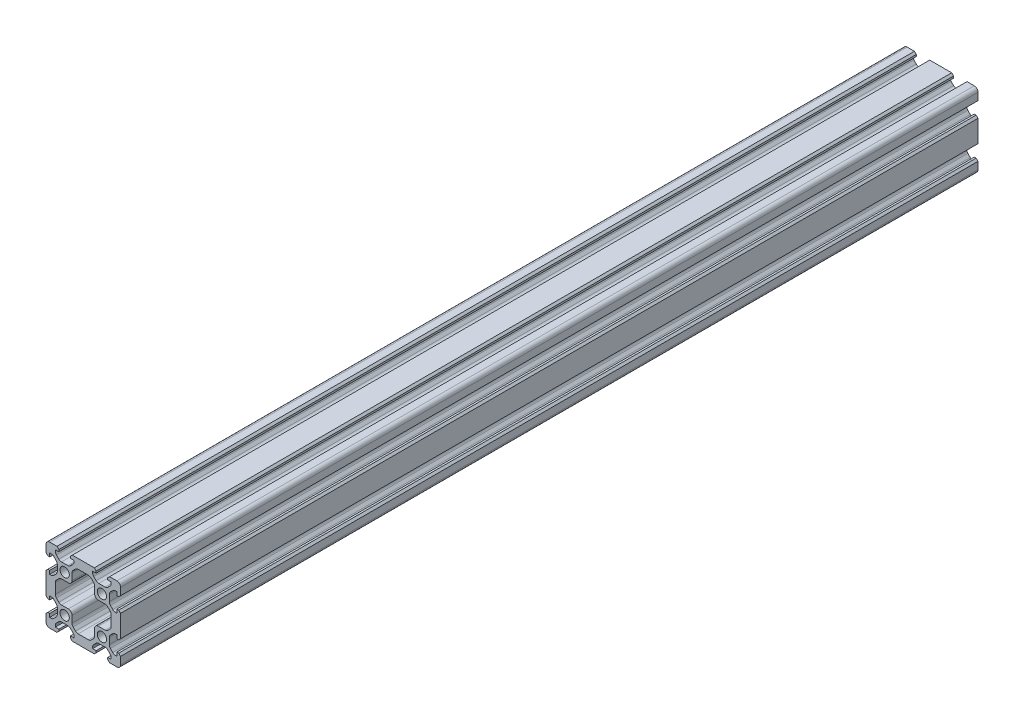
from build123d import *

# Parameters (mm, degrees)
SKETCH1_R           = 2.5
BOSS_EXTRUDE1_DEPTH = 460


with BuildPart() as part:
    # Sketch1 → Boss-Extrude1 (new body)
    with BuildSketch(Plane.XY):
        with BuildLine():
            Line((-13.1, -19), (-14.1, -20))
            Line((-14.1, -20), (-18, -20))
            ThreePointArc((-18, -20), (-19.414213562, -19.414213562), (-20, -18))
            Line((-20, -18), (-20, -14.1))
            Line((-20, -14.1), (-19, -13.1))
            Line((-19, -13.1), (-18, -13.1))
            Line((-18, -13.1), (-18, -15))
            Line((-18, -15), (-17.242640687, -15))
            ThreePointArc((-17.242640687, -15), (-16.477273822, -14.847759065), (-15.828427125, -14.414213562))
            Line((-15.828427125, -14.414213562), (-14.537854624, -13.123641061))
            ThreePointArc((-14.537854624, -13.123641061), (-14.104309121, -12.474794364), (-13.952068186, -11.709427499))
            Line((-13.952068186, -11.709427499), (-13.952068186, -8.290572501))
            ThreePointArc((-13.952068186, -8.290572501), (-14.104309121, -7.525205636), (-14.537854624, -6.876358939))
            Line((-14.537854624, -6.876358939), (-15.828427125, -5.585786438))
            ThreePointArc((-15.828427125, -5.585786438), (-16.477273822, -5.152240935), (-17.242640687, -5))
            Line((-17.242640687, -5), (-18, -5))
            Line((-18, -5), (-18, -6.9))
            Line((-18, -6.9), (-19, -6.9))
            Line((-19, -6.9), (-20, -5.9))
            Line((-20, -5.9), (-20, 5.9))
            Line((-20, 5.9), (-19, 6.9))
            Line((-19, 6.9), (-18, 6.9))
            Line((-18, 6.9), (-18, 5))
            Line((-18, 5), (-17.242640687, 5))
            ThreePointArc((-17.242640687, 5), (-16.477273822, 5.152240935), (-15.828427125, 5.585786438))
            Line((-15.828427125, 5.585786438), (-14.537854624, 6.876358939))
            ThreePointArc((-14.537854624, 6.876358939), (-14.104309121, 7.525205636), (-13.952068186, 8.290572501))
            Line((-13.952068186, 8.290572501), (-13.952068186, 11.709427499))
            ThreePointArc((-13.952068186, 11.709427499), (-14.104309121, 12.474794364), (-14.537854624, 13.123641061))
            Line((-14.537854624, 13.123641061), (-15.828427125, 14.414213562))
            ThreePointArc((-15.828427125, 14.414213562), (-16.477273822, 14.847759065), (-17.242640687, 15))
            Line((-17.242640687, 15), (-18, 15))
            Line((-18, 15), (-18, 13.1))
            Line((-18, 13.1), (-19, 13.1))
            Line((-19, 13.1), (-20, 14.1))
            Line((-20, 14.1), (-20, 18))
            ThreePointArc((-20, 18), (-19.414213562, 19.414213562), (-18, 20))
            Line((-18, 20), (-14.1, 20))
            Line((-14.1, 20), (-13.1, 19))
            Line((-13.1, 19), (-13.1, 18))
            Line((-13.1, 18), (-15, 18))
            Line((-15, 18), (-15, 17.242640687))
            ThreePointArc((-15, 17.242640687), (-14.847759065, 16.477273822), (-14.414213562, 15.828427125))
            Line((-14.414213562, 15.828427125), (-13.123641061, 14.537854624))
            ThreePointArc((-13.123641061, 14.537854624), (-12.474794364, 14.104309121), (-11.709427499, 13.952068186))
            Line((-11.709427499, 13.952068186), (-8.290572501, 13.952068186))
            ThreePointArc((-8.290572501, 13.952068186), (-7.525205636, 14.104309121), (-6.876358939, 14.537854624))
            Line((-6.876358939, 14.537854624), (-5.585786438, 15.828427125))
            ThreePointArc((-5.585786438, 15.828427125), (-5.152240935, 16.477273822), (-5, 17.242640687))
            Line((-5, 17.242640687), (-5, 18))
            Line((-5, 18), (-6.9, 18))
            Line((-6.9, 18), (-6.9, 19))
            Line((-6.9, 19), (-5.9, 20))
            Line((-5.9, 20), (5.9, 20))
            Line((5.9, 20), (6.9, 19))
            Line((6.9, 19), (6.9, 18))
            Line((6.9, 18), (5, 18))
            Line((5, 18), (5, 17.242640687))
            ThreePointArc((5, 17.242640687), (5.152240935, 16.477273822), (5.585786438, 15.828427125))
            Line((5.585786438, 15.828427125), (6.876358939, 14.537854624))
            ThreePointArc((6.876358939, 14.537854624), (7.525205636, 14.104309121), (8.290572501, 13.952068186))
            Line((8.290572501, 13.952068186), (11.709427499, 13.952068186))
            ThreePointArc((11.709427499, 13.952068186), (12.474794364, 14.104309121), (13.123641061, 14.537854624))
            Line((13.123641061, 14.537854624), (14.414213562, 15.828427125))
            ThreePointArc((14.414213562, 15.828427125), (14.847759065, 16.477273822), (15, 17.242640687))
            Line((15, 17.242640687), (15, 18))
            Line((15, 18), (13.1, 18))
            Line((13.1, 18), (13.1, 19))
            Line((13.1, 19), (14.1, 20))
            Line((14.1, 20), (18, 20))
            ThreePointArc((18, 20), (19.414213562, 19.414213562), (20, 18))
            Line((20, 18), (20, 14.1))
            Line((20, 14.1), (19, 13.1))
            Line((19, 13.1), (18, 13.1))
            Line((18, 13.1), (18, 15))
            Line((18, 15), (17.242640687, 15))
            ThreePointArc((17.242640687, 15), (16.477273822, 14.847759065), (15.828427125, 14.414213562))
            Line((15.828427125, 14.414213562), (14.537854624, 13.123641061))
            ThreePointArc((14.537854624, 13.123641061), (14.104309121, 12.474794364), (13.952068186, 11.709427499))
            Line((13.952068186, 11.709427499), (13.952068186, 8.290572501))
            ThreePointArc((13.952068186, 8.290572501), (14.104309121, 7.525205636), (14.537854624, 6.876358939))
            Line((14.537854624, 6.876358939), (15.828427125, 5.585786438))
            ThreePointArc((15.828427125, 5.585786438), (16.477273822, 5.152240935), (17.242640687, 5))
            Line((17.242640687, 5), (18, 5))
            Line((18, 5), (18, 6.9))
            Line((18, 6.9), (19, 6.9))
            Line((19, 6.9), (20, 5.9))
            Line((20, 5.9), (20, -5.9))
            Line((20, -5.9), (19, -6.9))
            Line((19, -6.9), (18, -6.9))
            Line((18, -6.9), (18, -5))
            Line((18, -5), (17.242640687, -5))
            ThreePointArc((17.242640687, -5), (16.477273822, -5.152240935), (15.828427125, -5.585786438))
            Line((15.828427125, -5.585786438), (14.537854624, -6.876358939))
            ThreePointArc((14.537854624, -6.876358939), (14.104309121, -7.525205636), (13.952068186, -8.290572501))
            Line((13.952068186, -8.290572501), (13.952068186, -11.709427499))
            ThreePointArc((13.952068186, -11.709427499), (14.104309121, -12.474794364), (14.537854624, -13.123641061))
            Line((14.537854624, -13.123641061), (15.828427125, -14.414213562))
            ThreePointArc((15.828427125, -14.414213562), (16.477273822, -14.847759065), (17.242640687, -15))
            Line((17.242640687, -15), (18, -15))
            Line((18, -15), (18, -13.1))
            Line((18, -13.1), (19, -13.1))
            Line((19, -13.1), (20, -14.1))
            Line((20, -14.1), (20, -18))
            ThreePointArc((20, -18), (19.414213562, -19.414213562), (18, -20))
            Line((18, -20), (14.1, -20))
            Line((14.1, -20), (13.1, -19))
            Line((13.1, -19), (13.1, -18))
            Line((13.1, -18), (15, -18))
            Line((15, -18), (15, -17.242640687))
            ThreePointArc((15, -17.242640687), (14.847759065, -16.477273822), (14.414213562, -15.828427125))
            Line((14.414213562, -15.828427125), (13.123641061, -14.537854624))
            ThreePointArc((13.123641061, -14.537854624), (12.474794364, -14.104309121), (11.709427499, -13.952068186))
            Line((11.709427499, -13.952068186), (8.290572501, -13.952068186))
            ThreePointArc((8.290572501, -13.952068186), (7.525205636, -14.104309121), (6.876358939, -14.537854624))
            Line((6.876358939, -14.537854624), (5.585786438, -15.828427125))
            ThreePointArc((5.585786438, -15.828427125), (5.152240935, -16.477273822), (5, -17.242640687))
            Line((5, -17.242640687), (5, -18))
            Line((5, -18), (6.9, -18))
            Line((6.9, -18), (6.9, -19))
            Line((6.9, -19), (5.9, -20))
            Line((5.9, -20), (-5.9, -20))
            Line((-5.9, -20), (-6.9, -19))
            Line((-6.9, -19), (-6.9, -18))
            Line((-6.9, -18), (-5, -18))
            Line((-5, -18), (-5, -17.242640687))
            ThreePointArc((-5, -17.242640687), (-5.152240935, -16.477273822), (-5.585786438, -15.828427125))
            Line((-5.585786438, -15.828427125), (-6.876358939, -14.537854624))
            ThreePointArc((-6.876358939, -14.537854624), (-7.525205636, -14.104309121), (-8.290572501, -13.952068186))
            Line((-8.290572501, -13.952068186), (-11.709427499, -13.952068186))
            ThreePointArc((-11.709427499, -13.952068186), (-12.474794364, -14.104309121), (-13.123641061, -14.537854624))
            Line((-13.123641061, -14.537854624), (-14.414213562, -15.828427125))
            ThreePointArc((-14.414213562, -15.828427125), (-14.847759065, -16.477273822), (-15, -17.242640687))
            Line((-15, -17.242640687), (-15, -18))
            Line((-15, -18), (-13.1, -18))
            Line((-13.1, -18), (-13.1, -19))
        make_face()
        with Locations((-10, -10)):
            Circle(SKETCH1_R, mode=Mode.SUBTRACT)
        with Locations((-10, 10)):
            Circle(SKETCH1_R, mode=Mode.SUBTRACT)
        with Locations((10, 10)):
            Circle(SKETCH1_R, mode=Mode.SUBTRACT)
        with Locations((10, -10)):
            Circle(SKETCH1_R, mode=Mode.SUBTRACT)
        with BuildLine():
            Line((-4.171572875, -14.414213562), (-5.462145376, -13.123641061))
            ThreePointArc((-5.462145376, -13.123641061), (-5.895690879, -12.474794364), (-6.047931814, -11.709427499))
            Line((-6.047931814, -11.709427499), (-6.047931814, -8.047931814))
            ThreePointArc((-6.047931814, -8.047931814), (-6.633718252, -6.633718252), (-8.047931814, -6.047931814))
            Line((-8.047931814, -6.047931814), (-11.709427499, -6.047931814))
            ThreePointArc((-11.709427499, -6.047931814), (-12.474794364, -5.895690879), (-13.123641061, -5.462145376))
            Line((-13.123641061, -5.462145376), (-14.414213562, -4.171572875))
            ThreePointArc((-14.414213562, -4.171572875), (-14.847759065, -3.522726178), (-15, -2.757359313))
            Line((-15, -2.757359313), (-15, 2.757359313))
            ThreePointArc((-15, 2.757359313), (-14.847759065, 3.522726178), (-14.414213562, 4.171572875))
            Line((-14.414213562, 4.171572875), (-13.123641061, 5.462145376))
            ThreePointArc((-13.123641061, 5.462145376), (-12.474794364, 5.895690879), (-11.709427499, 6.047931814))
            Line((-11.709427499, 6.047931814), (-8.047931814, 6.047931814))
            ThreePointArc((-8.047931814, 6.047931814), (-6.633718252, 6.633718252), (-6.047931814, 8.047931814))
            Line((-6.047931814, 8.047931814), (-6.047931814, 11.709427499))
            ThreePointArc((-6.047931814, 11.709427499), (-5.895690879, 12.474794364), (-5.462145376, 13.123641061))
            Line((-5.462145376, 13.123641061), (-4.171572875, 14.414213562))
            ThreePointArc((-4.171572875, 14.414213562), (-3.522726178, 14.847759065), (-2.757359313, 15))
            Line((-2.757359313, 15), (2.757359313, 15))
            ThreePointArc((2.757359313, 15), (3.522726178, 14.847759065), (4.171572875, 14.414213562))
            Line((4.171572875, 14.414213562), (5.462145376, 13.123641061))
            ThreePointArc((5.462145376, 13.123641061), (5.895690879, 12.474794364), (6.047931814, 11.709427499))
            Line((6.047931814, 11.709427499), (6.047931814, 8.047931814))
            ThreePointArc((6.047931814, 8.047931814), (6.633718252, 6.633718252), (8.047931814, 6.047931814))
            Line((8.047931814, 6.047931814), (11.709427499, 6.047931814))
            ThreePointArc((11.709427499, 6.047931814), (12.474794364, 5.895690879), (13.123641061, 5.462145376))
            Line((13.123641061, 5.462145376), (14.414213562, 4.171572875))
            ThreePointArc((14.414213562, 4.171572875), (14.847759065, 3.522726178), (15, 2.757359313))
            Line((15, 2.757359313), (15, -2.757359313))
            ThreePointArc((15, -2.757359313), (14.847759065, -3.522726178), (14.414213562, -4.171572875))
            Line((14.414213562, -4.171572875), (13.123641061, -5.462145376))
            ThreePointArc((13.123641061, -5.462145376), (12.474794364, -5.895690879), (11.709427499, -6.047931814))
            Line((11.709427499, -6.047931814), (8.047931814, -6.047931814))
            ThreePointArc((8.047931814, -6.047931814), (6.633718252, -6.633718252), (6.047931814, -8.047931814))
            Line((6.047931814, -8.047931814), (6.047931814, -11.709427499))
            ThreePointArc((6.047931814, -11.709427499), (5.895690879, -12.474794364), (5.462145376, -13.123641061))
            Line((5.462145376, -13.123641061), (4.171572875, -14.414213562))
            ThreePointArc((4.171572875, -14.414213562), (3.522726178, -14.847759065), (2.757359313, -15))
            Line((2.757359313, -15), (-2.757359313, -15))
            ThreePointArc((-2.757359313, -15), (-3.522726178, -14.847759065), (-4.171572875, -14.414213562))
        make_face(mode=Mode.SUBTRACT)
    extrude(amount=BOSS_EXTRUDE1_DEPTH)


solid = part.part
